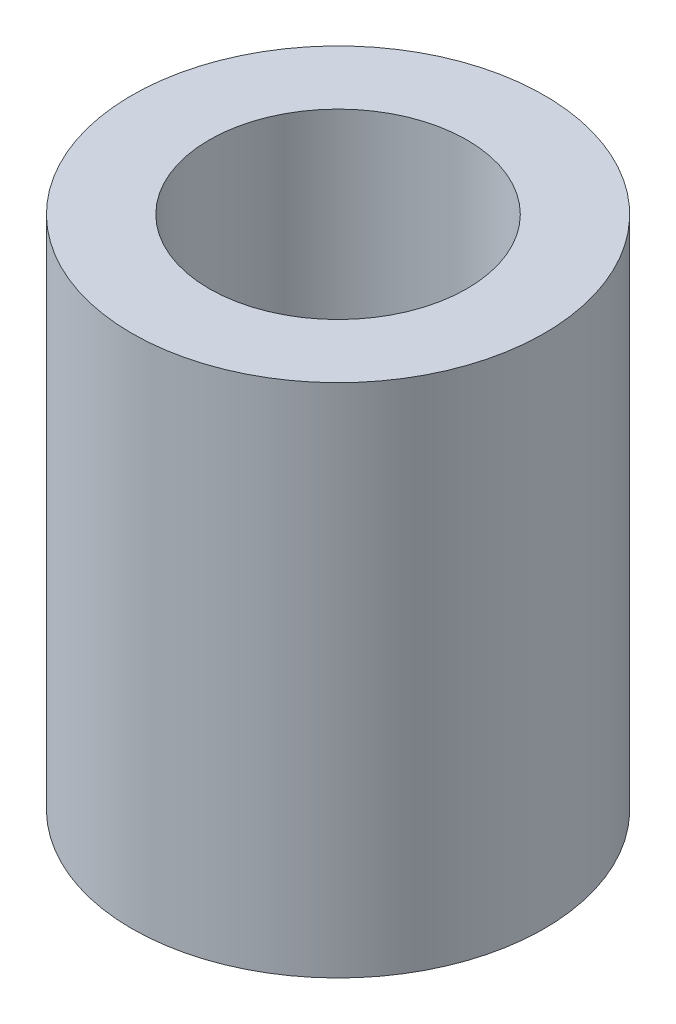
from build123d import *

# Parameters (mm, degrees)
SKETCH1_R           = 8
SKETCH1_R_2         = 5
BOSS_EXTRUDE1_DEPTH = 20


with BuildPart() as part:
    # Sketch1 → Boss-Extrude1 (new body)
    with BuildSketch(Plane(origin=(0, 0, 0), x_dir=(1, 0, 0), z_dir=(0, 1, 0))):
        with Locations(Location((0, 0, 0), (0, 0, 270))):
            Circle(SKETCH1_R)
        with Locations(Location((0, 0, 0), (0, 0, 270))):
            Circle(SKETCH1_R_2, mode=Mode.SUBTRACT)
    extrude(amount=BOSS_EXTRUDE1_DEPTH)


solid = part.part
